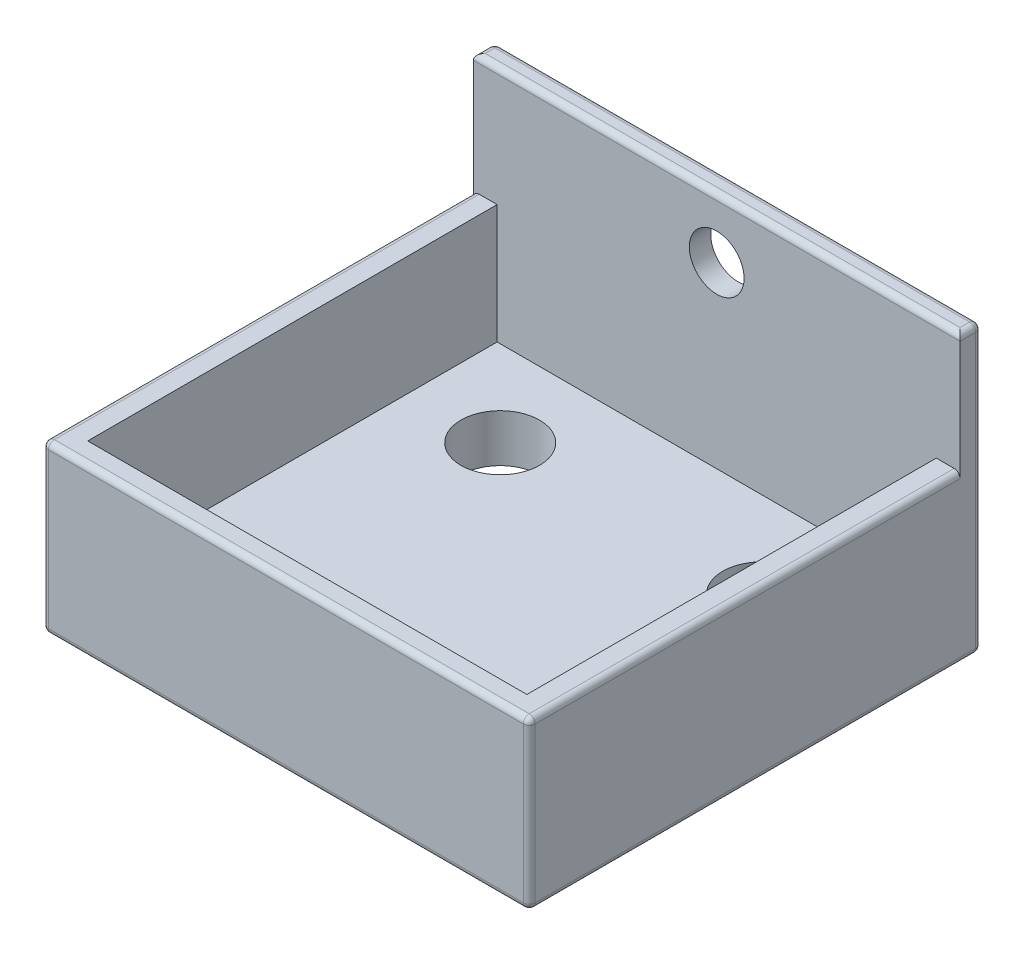
from build123d import *

# Parameters (mm, degrees)
SKETCH2_W           = 20.45
SKETCH2_H           = 19
BOSS_EXTRUDE1_DEPTH = 7
SKETCH3_W           = 18.45
SKETCH3_H           = 17.2
CUT_EXTRUDE1_DEPTH  = 5
SKETCH7_R           = 1.65
CUT_EXTRUDE2_DEPTH  = 2
SKETCH13_W          = 16
SKETCH13_H          = 2
CUT_EXTRUDE4_DEPTH  = 2
SKETCH15_W          = 20.45
SKETCH15_H          = 0.9
BOSS_EXTRUDE2_DEPTH = 5
SKETCH16_R          = 1.15
CUT_EXTRUDE5_DEPTH  = 0.9
FILLET2_R           = 0.25


with BuildPart() as part:
    # Sketch2 → Boss-Extrude1 (new body)
    with BuildSketch(Plane(origin=(0, 0, 0), x_dir=(1, 0, 0), z_dir=(0, 1, 0))):
        Rectangle(SKETCH2_W, SKETCH2_H)
    extrude(amount=BOSS_EXTRUDE1_DEPTH)

    # Sketch3 → Cut-Extrude1 (cut)
    with BuildSketch(Plane(origin=(0, 7, 0), x_dir=(1, 0, 0), z_dir=(0, 1, 0))):
        Rectangle(SKETCH3_W, SKETCH3_H)
    extrude(amount=-CUT_EXTRUDE1_DEPTH, mode=Mode.SUBTRACT)

    # Sketch7 → Cut-Extrude2 (cut)
    with BuildSketch(Plane(origin=(0, 2, 0), x_dir=(1, 0, 0), z_dir=(0, 1, 0))):
        with Locations(Location((-5.495, 5, 0), (0, 0, 270))):
            Circle(SKETCH7_R)
        with Locations(Location((5.505, 5, 0), (0, 0, 270))):
            Circle(SKETCH7_R)
    extrude(amount=-CUT_EXTRUDE2_DEPTH, mode=Mode.SUBTRACT)

    # Sketch13 → Cut-Extrude4 (cut)
    with BuildSketch(Plane(origin=(0, 2, 0), x_dir=(1, 0, 0), z_dir=(0, 1, 0))):
        with Locations((0, -5)):
            Rectangle(SKETCH13_W, SKETCH13_H)
    extrude(amount=-CUT_EXTRUDE4_DEPTH, mode=Mode.SUBTRACT)

    # Sketch15 → Boss-Extrude2 (add)
    with BuildSketch(Plane(origin=(0, 7, 0), x_dir=(1, 0, 0), z_dir=(0, 1, 0))):
        with Locations((0, 9.05)):
            Rectangle(SKETCH15_W, SKETCH15_H)
    extrude(amount=BOSS_EXTRUDE2_DEPTH)

    # Sketch16 → Cut-Extrude5 (cut)
    with BuildSketch(Plane.XY.offset(-8.6)):
        with Locations((0, 9.5)):
            Circle(SKETCH16_R)
    extrude(amount=-CUT_EXTRUDE5_DEPTH, mode=Mode.SUBTRACT)

    # Fillet2
    fillet2_edges = [part.edges().sort_by_distance(p)[0] for p in [
        (10.225, 7, 0.45),
        (0, 0, -9.5),
        (-10.225, 7, 0.45),
        (10.225, 0, 0),
        (-10.225, 12, -9.05),
        (0, 12, -8.6),
        (10.225, 12, -9.05),
        (0, 0, 9.5),
        (0, 12, -9.5),
        (-10.225, 0, 0),
        (-10.225, 6, -9.5),
        (10.225, 6, -9.5),
        (10.225, 3.5, 9.5),
        (-10.225, 3.5, 9.5),
        (0, 7, 9.5),
    ]]
    fillet(fillet2_edges, radius=FILLET2_R)


solid = part.part
